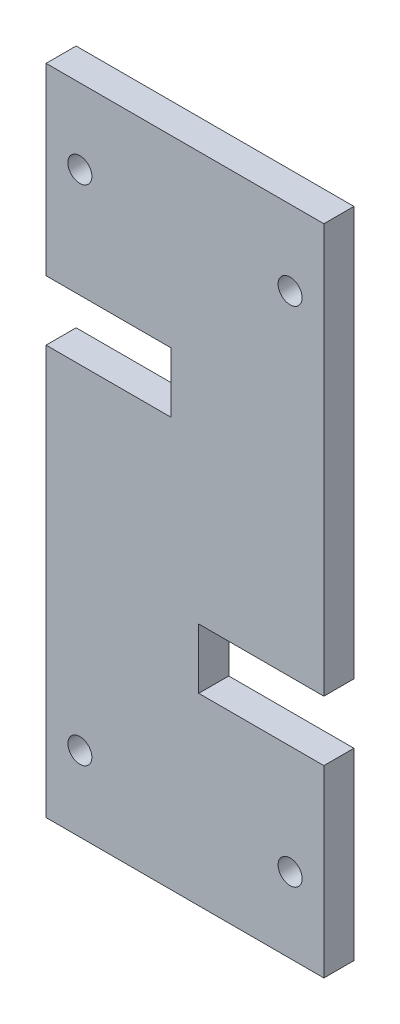
from build123d import *

# Parameters (mm, degrees)
SKETCH_1_W          = 37
SKETCH_1_H          = 87
SKETCH_1_R          = 1.6
EXTRUDE_1_DEPTH     = 4
SKETCH_2_W          = 16.67
SKETCH_2_H          = 8
CUT_EXTRUDE_1_DEPTH = 48.439435073


with BuildPart() as part:
    # 草图1 → 凸台-拉伸1 (new body)
    with BuildSketch(Plane.XY):
        Rectangle(SKETCH_1_W, SKETCH_1_H)
        with Locations((-14, 33.5)):
            Circle(SKETCH_1_R, mode=Mode.SUBTRACT)
        with Locations((14, 33.5)):
            Circle(SKETCH_1_R, mode=Mode.SUBTRACT)
        with Locations((-14, -33.5)):
            Circle(SKETCH_1_R, mode=Mode.SUBTRACT)
        with Locations((14, -33.5)):
            Circle(SKETCH_1_R, mode=Mode.SUBTRACT)
    extrude(amount=EXTRUDE_1_DEPTH)

    # 草图2 → 切除-拉伸1 (cut, through all)
    with BuildSketch(Plane.XY.offset(4)):
        with Locations((-10.165, 15)):
            Rectangle(SKETCH_2_W, SKETCH_2_H)
        with Locations((10.165, -15)):
            Rectangle(SKETCH_2_W, SKETCH_2_H)
    extrude(amount=-CUT_EXTRUDE_1_DEPTH, mode=Mode.SUBTRACT)


solid = part.part
